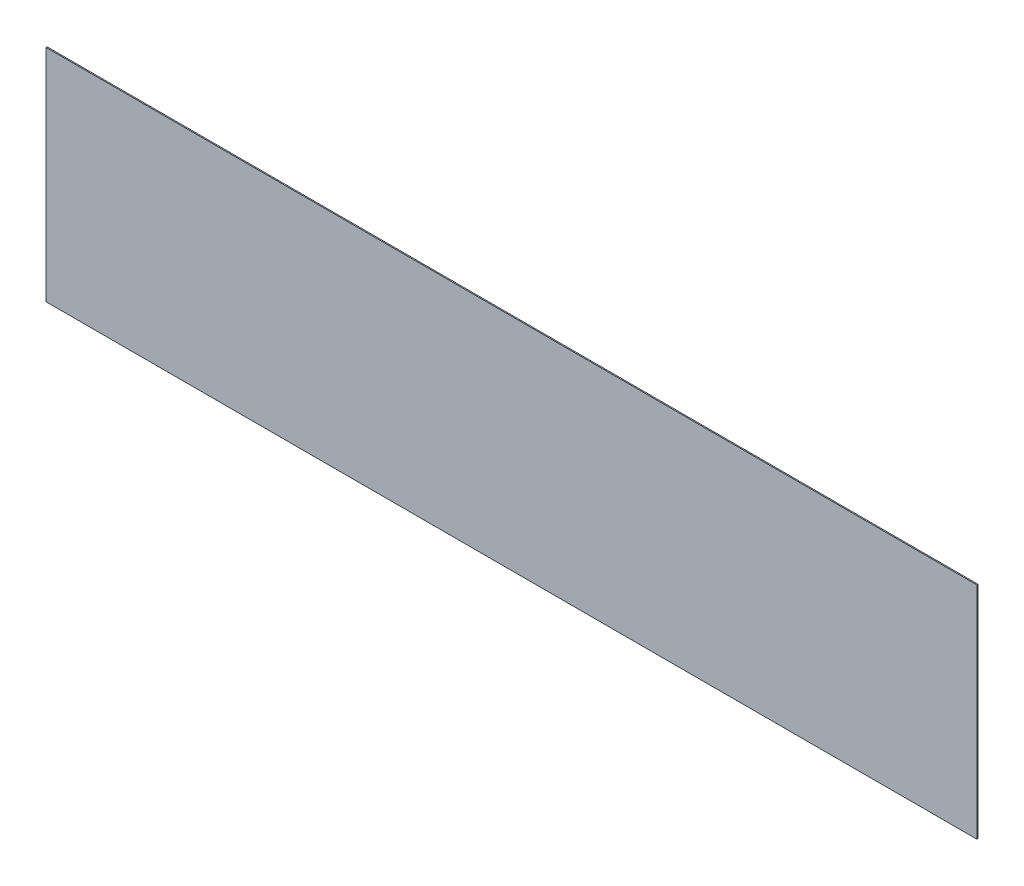
from build123d import *

# Parameters (mm, degrees)
STORE_PANEL_SOGUTMA_1_START = 38.5
SKETCH1_W                   = 1268
SKETCH1_H                   = 300
STORE_PANEL_SOGUTMA_1_DEPTH = 1.5


with BuildPart() as part:
    # Sketch1 → STORE_panel_sogutma_1 (new body)
    with BuildSketch(Plane.XY.offset(STORE_PANEL_SOGUTMA_1_START)):
        with Locations((700, 1820)):
            Rectangle(SKETCH1_W, SKETCH1_H)
    extrude(amount=STORE_PANEL_SOGUTMA_1_DEPTH)


solid = part.part
